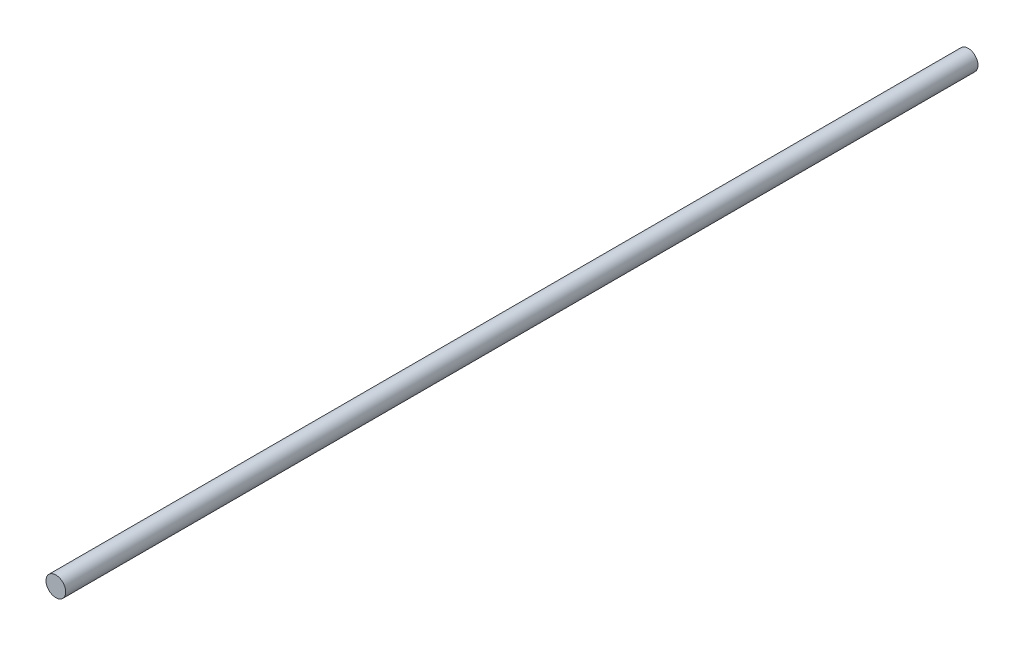
from build123d import *

# Parameters (mm, degrees)
SKETCH_1_R      = 4
EXTRUDE_1_DEPTH = 370


with BuildPart() as part:
    # 草图1 → 凸台-拉伸1 (new body)
    with BuildSketch(Plane.XY):
        Circle(SKETCH_1_R)
    extrude(amount=EXTRUDE_1_DEPTH)


solid = part.part
